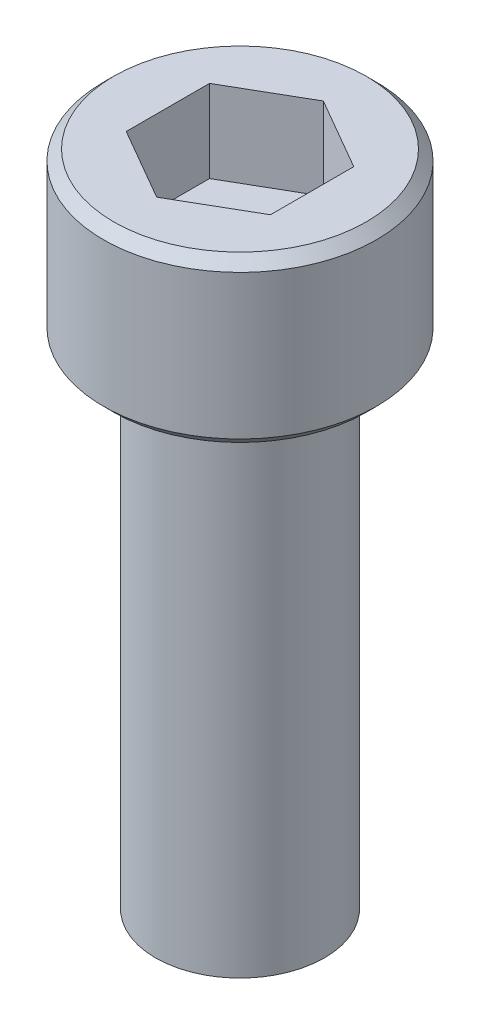
from build123d import *

# Parameters (mm, degrees)
SKETCH1_W           = 3.3655
SKETCH1_H           = 4.064
SKETCH2_R           = 2.0828
BOSS_EXTRUDE1_DEPTH = 12.7
CUT_EXTRUDE1_DEPTH  = 2.032
CHAMFER1_SIZE       = 0.254
CHAMFER2_SIZE       = 0.76962
CHAMFER2_SIZE2      = 0.53848


with BuildPart() as part:
    # Sketch1 → Revolve1 (revolve)
    with BuildSketch(Plane.XY):
        with Locations((1.68275, 2.032)):
            Rectangle(SKETCH1_W, SKETCH1_H)
    revolve(axis=Axis((0, 4.064, 0), (0, -1, 0)))

    # Sketch2 → Boss-Extrude1 (add)
    with BuildSketch(Plane.XZ):
        Circle(SKETCH2_R)
    extrude(amount=BOSS_EXTRUDE1_DEPTH)

    # Sketch3 → Cut-Extrude1 (cut)
    with BuildSketch(Plane(origin=(0, 4.064, 0), x_dir=(-1, 0, 0), z_dir=(0, 1, 0))):
        Polygon((-1.778, -1.026528779), (0, -2.053057557), (1.778, -1.026528779), (1.778, 1.026528779), (0, 2.053057557), (-1.778, 1.026528779), align=None)
    extrude(amount=-CUT_EXTRUDE1_DEPTH, mode=Mode.SUBTRACT)

    # Chamfer1
    chamfer1_edges = [part.edges().sort_by_distance(p)[0] for p in [
        (-3.3655, 0, 0),
        (-3.3655, 4.064, 0),
    ]]
    chamfer(chamfer1_edges, length=CHAMFER1_SIZE)

    # Chamfer2
    chamfer2_edges = [part.edges().sort_by_distance(p)[0] for p in [
        (-2.0828, -12.7, 0),
    ]]
    chamfer2_side = [part.faces().sort_by_distance(p)[0] for p in [
        (0, -12.7, 0),
    ]]
    chamfer(chamfer2_edges, length=CHAMFER2_SIZE, length2=CHAMFER2_SIZE2, reference=chamfer2_side[0])


solid = part.part
